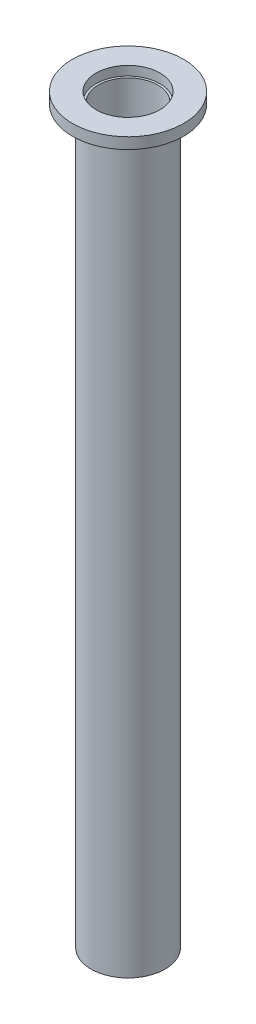
from build123d import *


with BuildPart() as part:
    # Reconstructed nominal axial profile → Native revolved geometry (revolve)
    with BuildSketch(Plane.XY, mode=Mode.PRIVATE) as native_revolved_geometry_sk:
        Polygon((8.6, -78), (8.6, -80.5), (8, -80.5), (8, -278), (10, -278), (10, -82.339745962), (15, -81), (15, -78), align=None)
    revolve(native_revolved_geometry_sk.sketch.rotate(Axis((0, -500, 0), (0, 1, 0)), 90), axis=Axis((0, -500, 0), (0, 1, 0)))


solid = part.part
